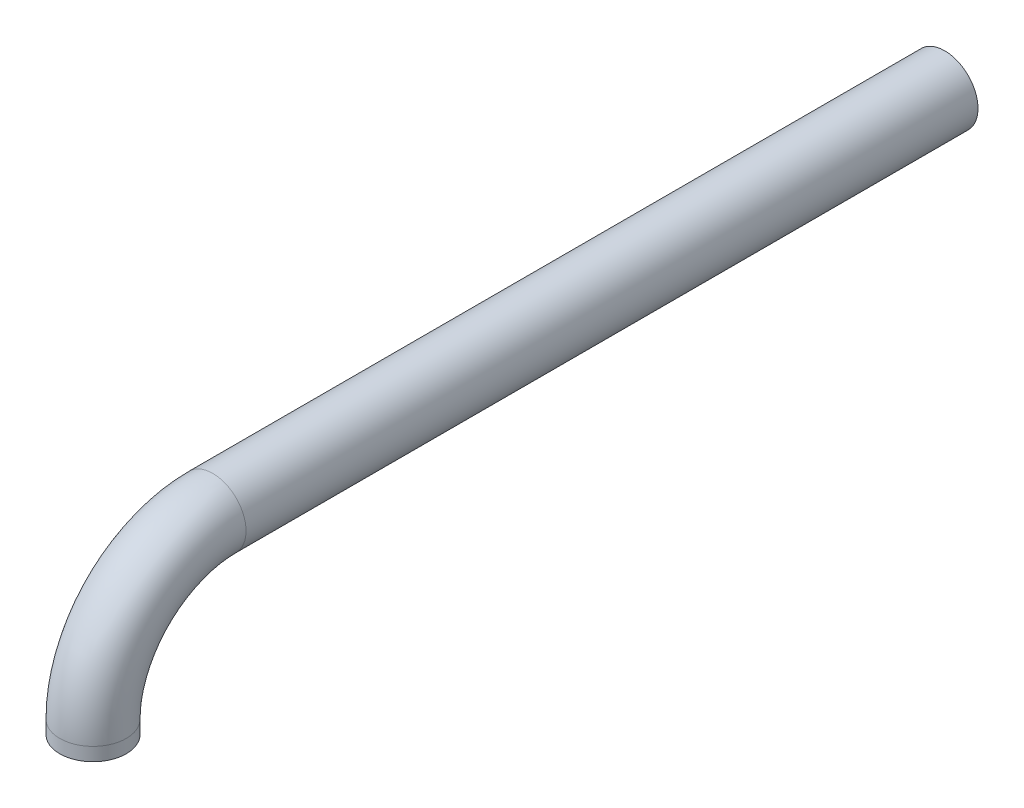
from build123d import *

# Parameters (mm, degrees)
SKIZZE2_R   = 1.25
SKIZZE2_R_2 = 1


with BuildPart() as part:
    # Austragung1: sweep along a path in Skizze1
    with BuildLine(Plane(origin=(0, 0, 0), x_dir=(0, 0, -1), z_dir=(1, 0, 0))) as austragung1_path:
        Line((0, 0), (0, 0.5))
        ThreePointArc((0, 0.5), (1.318019485, 3.681980515), (4.5, 5))
        Line((4.5, 5), (32, 5))
    # Skizze2 → Austragung1 (sweep)
    with BuildSketch(Plane(origin=(0, 0, 0), x_dir=(1, 0, 0), z_dir=(0, 1, 0))):
        Circle(SKIZZE2_R)
        Circle(SKIZZE2_R_2, mode=Mode.SUBTRACT)
    sweep(path=austragung1_path.line)


solid = part.part
